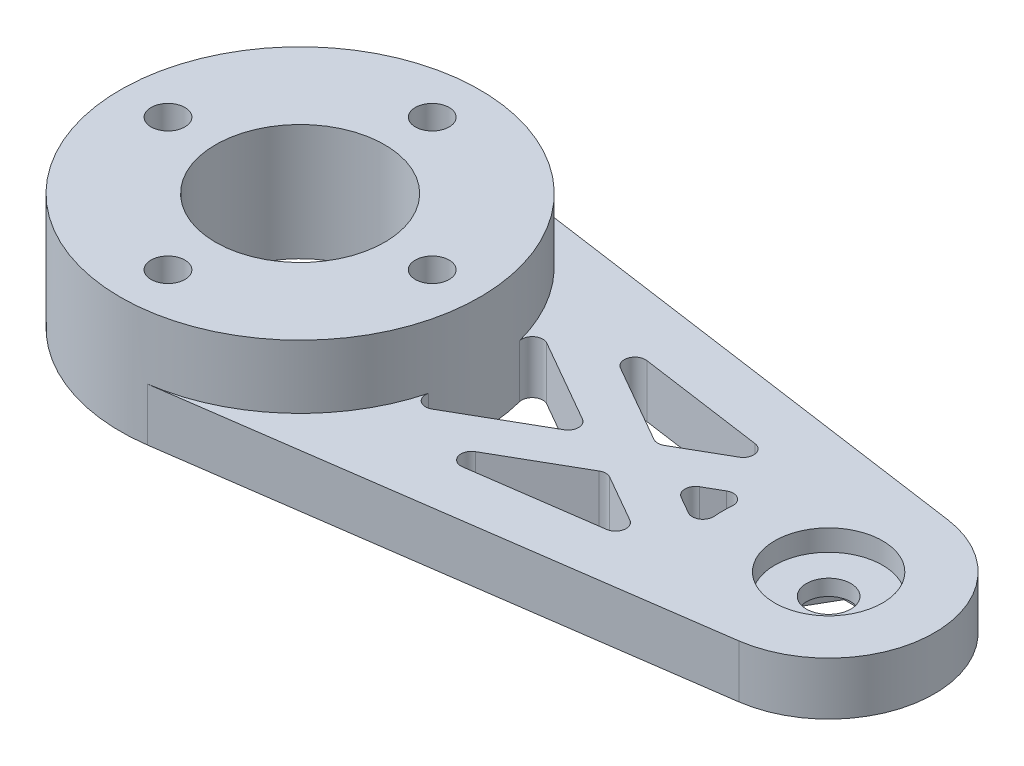
from build123d import *

# Parameters (mm, degrees)
SKETCH_1_R          = 1.6
SKETCH_1_R_2        = 8
SKETCH_1_R_3        = 5.1
EXTRUDE_1_DEPTH     = 5
SKETCH_1_3_R        = 5.1
SKETCH_1_3_R_2      = 2.1
EXTRUDE_2_DEPTH     = 3
FILLET_1_R          = 1
FILLET_2_R          = 1
FILLET_3_R          = 1
FILLET_4_R          = 1
CUT_EXTRUDE_1_DEPTH = 1.5
SKETCH_3_R          = 17
SKETCH_3_R_2        = 8
SKETCH_3_R_3        = 1.6
EXTRUDE_4_DEPTH     = 6


with BuildPart() as part:
    # 草图1 → 凸台-拉伸1 (new body)
    with BuildSketch(Plane(origin=(0, 0, 0), x_dir=(1, 0, 0), z_dir=(0, 1, 0))):
        with BuildLine():
            ThreePointArc((2.38, 16.832575561), (-17, 0), (2.38, -16.832575561))
            Line((2.38, -16.832575561), (51.4, -9.901515036))
            ThreePointArc((51.4, -9.901515036), (60, 0), (51.4, 9.901515036))
            Line((51.4, 9.901515036), (2.38, 16.832575561))
        make_face()
        with Locations((0, -12.5)):
            Circle(SKETCH_1_R, mode=Mode.SUBTRACT)
        Polygon((38.90018853, -6.619162403), (18.93798634, -9.441668148), (31.379588649, -2.305623307), align=None, mode=Mode.SUBTRACT)
        with Locations((-12.5, 0)):
            Circle(SKETCH_1_R, mode=Mode.SUBTRACT)
        Circle(SKETCH_1_R_2, mode=Mode.SUBTRACT)
        with Locations((12.5, 0)):
            Circle(SKETCH_1_R, mode=Mode.SUBTRACT)
        with BuildLine():
            ThreePointArc((15.606195444, -6.741414077), (17, 0), (15.606195444, 6.741414077))
            Line((15.606195444, 6.741414077), (27.359764097, 0))
            Line((27.359764097, 0), (15.606195444, -6.741414077))
        make_face(mode=Mode.SUBTRACT)
        with Locations((0, 12.5)):
            Circle(SKETCH_1_R, mode=Mode.SUBTRACT)
        with BuildLine():
            Line((40.424329865, -2.882107123), (35.399413201, 0))
            Line((35.399413201, 0), (40.424329865, 2.882107123))
            ThreePointArc((40.424329865, 2.882107123), (40, 0), (40.424329865, -2.882107123))
        make_face(mode=Mode.SUBTRACT)
        Polygon((31.379588649, 2.305623307), (18.93798634, 9.441668148), (38.90018853, 6.619162403), align=None, mode=Mode.SUBTRACT)
        with Locations((50, 0)):
            Circle(SKETCH_1_R_3, mode=Mode.SUBTRACT)
    extrude(amount=EXTRUDE_1_DEPTH)

    # 草图1<3> → 凸台-拉伸2 (add)
    with BuildSketch(Plane(origin=(0, 0, 0), x_dir=(1, 0, 0), z_dir=(0, 1, 0))):
        with Locations((50, 0)):
            Circle(SKETCH_1_3_R)
        with Locations((50, 0)):
            Circle(SKETCH_1_3_R_2, mode=Mode.SUBTRACT)
    extrude(amount=EXTRUDE_2_DEPTH)

    # 圆角1
    fillet_1_edges = [part.edges().sort_by_distance(p)[0] for p in [
        (35.399413201, 2.5, 0),
        (40.424329865, 2.5, -2.882107123),
        (40.424329865, 2.5, 2.882107123),
    ]]
    fillet(fillet_1_edges, radius=FILLET_1_R)

    # 圆角2
    fillet_2_edges = [part.edges().sort_by_distance(p)[0] for p in [
        (31.379588649, 2.5, 2.305623307),
        (18.93798634, 2.5, 9.441668148),
        (38.90018853, 2.5, 6.619162403),
    ]]
    fillet(fillet_2_edges, radius=FILLET_2_R)

    # 圆角3
    fillet_3_edges = [part.edges().sort_by_distance(p)[0] for p in [
        (18.93798634, 2.5, -9.441668148),
        (31.379588649, 2.5, -2.305623307),
        (38.90018853, 2.5, -6.619162403),
    ]]
    fillet(fillet_3_edges, radius=FILLET_3_R)

    # 圆角4
    fillet_4_edges = [part.edges().sort_by_distance(p)[0] for p in [
        (15.606195444, 2.5, -6.741414077),
        (27.359764097, 2.5, 0),
        (15.606195444, 2.5, 6.741414077),
    ]]
    fillet(fillet_4_edges, radius=FILLET_4_R)

    # 草图2 → 切除-拉伸1 (cut)
    with BuildSketch(Plane.XZ):
        Polygon((53.983716857, 0), (51.991858429, 3.45), (48.008141571, 3.45), (46.016283143, 0), (48.008141571, -3.45), (51.991858429, -3.45), align=None)
    extrude(amount=-CUT_EXTRUDE_1_DEPTH, mode=Mode.SUBTRACT)

    # 草图3 → 凸台-拉伸4 (add)
    with BuildSketch(Plane(origin=(0, 5, 0), x_dir=(1, 0, 0), z_dir=(0, 1, 0))):
        Circle(SKETCH_3_R)
        Circle(SKETCH_3_R_2, mode=Mode.SUBTRACT)
        with Locations((0, -12.5)):
            Circle(SKETCH_3_R_3, mode=Mode.SUBTRACT)
        with Locations((12.5, 0)):
            Circle(SKETCH_3_R_3, mode=Mode.SUBTRACT)
        with Locations((0, 12.5)):
            Circle(SKETCH_3_R_3, mode=Mode.SUBTRACT)
        with Locations((-12.5, 0)):
            Circle(SKETCH_3_R_3, mode=Mode.SUBTRACT)
    extrude(amount=EXTRUDE_4_DEPTH)


solid = part.part
